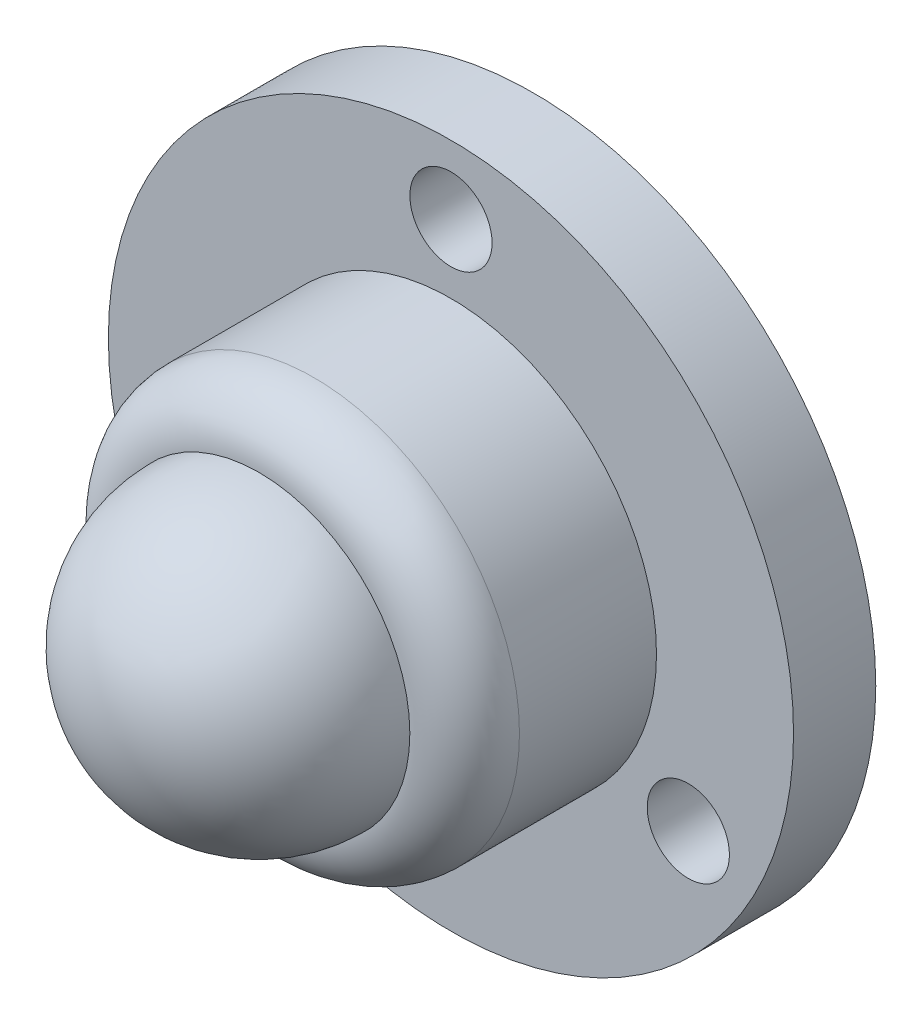
from build123d import *

# Parameters (mm, degrees)
SKETCH2_R           = 1.25
SKETCH2_R_2         = 0.15
BOSS_EXTRUDE1_DEPTH = 0.3
SKETCH3_R           = 0.75
BOSS_EXTRUDE2_DEPTH = 0.7
FILLET2_R           = 0.2


with BuildPart() as part:
    # Sketch2 → Boss-Extrude1 (new body)
    with BuildSketch(Plane.XY):
        Circle(SKETCH2_R)
        with Locations((0, 1)):
            Circle(SKETCH2_R_2, mode=Mode.SUBTRACT)
        with Locations((0.866025404, -0.5)):
            Circle(SKETCH2_R_2, mode=Mode.SUBTRACT)
        with Locations((-0.866025404, -0.5)):
            Circle(SKETCH2_R_2, mode=Mode.SUBTRACT)
    extrude(amount=BOSS_EXTRUDE1_DEPTH)

    # Sketch3 → Boss-Extrude2 (add)
    with BuildSketch(Plane.XY.offset(0.3)):
        Circle(SKETCH3_R)
    extrude(amount=BOSS_EXTRUDE2_DEPTH)

    # Fillet2
    fillet2_edges = [part.edges().sort_by_distance(p)[0] for p in [
        (-0.75, 0, 1),
    ]]
    fillet(fillet2_edges, radius=FILLET2_R)

    # Sketch5 → Revolve2 (revolve)
    with BuildSketch(Plane.XY.offset(1)):
        with BuildLine():
            Line((-0.55, 0), (0.55, 0))
            ThreePointArc((0.55, 0), (0, 0.55), (-0.55, 0))
        make_face()
    revolve(axis=Axis((-0.55, 0, 1), (1, 0, 0)))


solid = part.part
